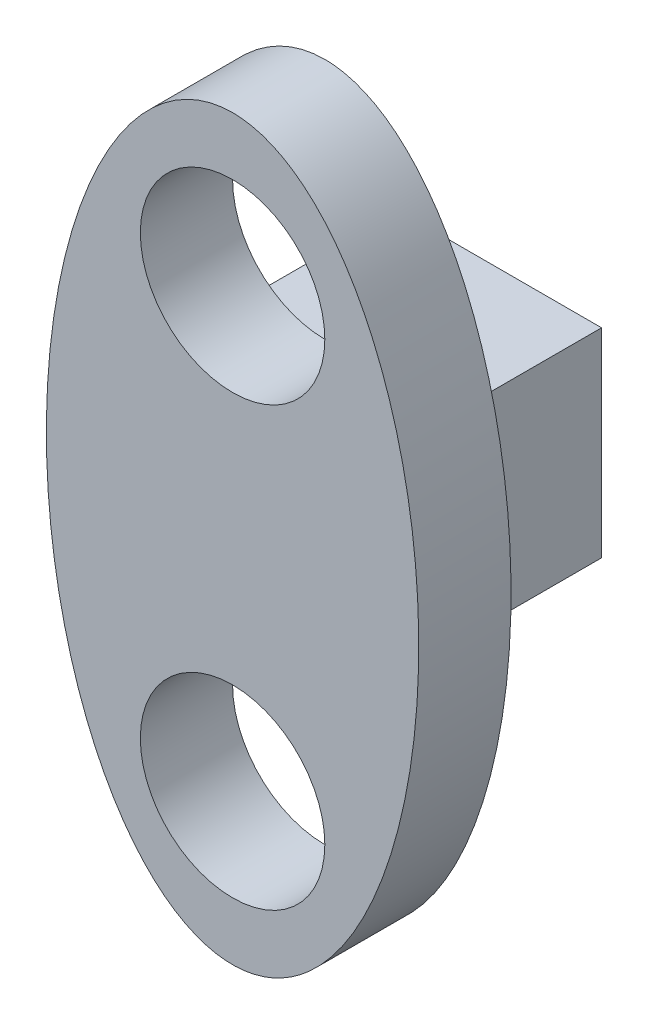
from build123d import *
from OCP.BRepFilletAPI import BRepFilletAPI_MakeFillet

# Parameters (mm, degrees)
ESQUISSE4_W             = 5.5
ESQUISSE4_H             = 5.4
BOSS_EXTRU_2_DEPTH      = 4.7
ESQUISSE5_RX            = 10
ESQUISSE5_RY            = 5.046155586
ESQUISSE5_R             = 2.5
BOSS_EXTRU_4_DEPTH      = 2.5
ESQUISSE6_R             = 2.05
ENL_V_MAT_EXTRU_1_DEPTH = 4.32
CONG_1_R1               = 0.2
CONG_1_R2               = 0.35
CONG_1_R3               = 0.5


with BuildPart() as part:
    # Esquisse4 → Boss.-Extru.2 (new body)
    with BuildSketch(Plane.XY):
        with Locations((0.05, 0.05)):
            Rectangle(ESQUISSE4_W, ESQUISSE4_H)
    extrude(amount=BOSS_EXTRU_2_DEPTH)

    # Esquisse5 → Boss.-Extru.4 (add)
    with BuildSketch(Plane.XY.offset(4.7)):
        with Locations(Location((0, 0), (0, 0, 90))):
            Ellipse(ESQUISSE5_RX, ESQUISSE5_RY)
        with Locations((0, 5.93)):
            Circle(ESQUISSE5_R, mode=Mode.SUBTRACT)
        with Locations((0, -5.93)):
            Circle(ESQUISSE5_R, mode=Mode.SUBTRACT)
    extrude(amount=BOSS_EXTRU_4_DEPTH)

    # Esquisse6 → Enlèv. mat.-Extru.1 (cut)
    with BuildSketch(Plane(origin=(0, 0, 0), x_dir=(-1, 0, 0), z_dir=(0, 0, -1))):
        Circle(ESQUISSE6_R)
    extrude(amount=-ENL_V_MAT_EXTRU_1_DEPTH, mode=Mode.SUBTRACT)

    # Congé1: one fillet with a radius per group of edges: ONE call of the kernel's fillet builder (fillet() takes one radius for all edges)
    cong_1_edges_1 = [part.edges().sort_by_distance(p)[0] for p in [
        (2.05, 0, 4.32),
    ]]
    cong_1_edges_2 = [part.edges().sort_by_distance(p)[0] for p in [
        (2.8, 0.05, 4.7),
        (-2.7, 0.05, 4.7),
    ]]
    cong_1_edges_3 = [part.edges().sort_by_distance(p)[0] for p in [
        (0.05, 2.75, 4.7),
        (0.05, -2.65, 4.7),
    ]]
    cong_1 = BRepFilletAPI_MakeFillet(part.part.solid().wrapped)
    for e in cong_1_edges_1:
        cong_1.Add(CONG_1_R1, e.wrapped)
    for e in cong_1_edges_2:
        cong_1.Add(CONG_1_R2, e.wrapped)
    for e in cong_1_edges_3:
        cong_1.Add(CONG_1_R3, e.wrapped)
    add(Compound.cast(cong_1.Shape()), mode=Mode.REPLACE)


solid = part.part
